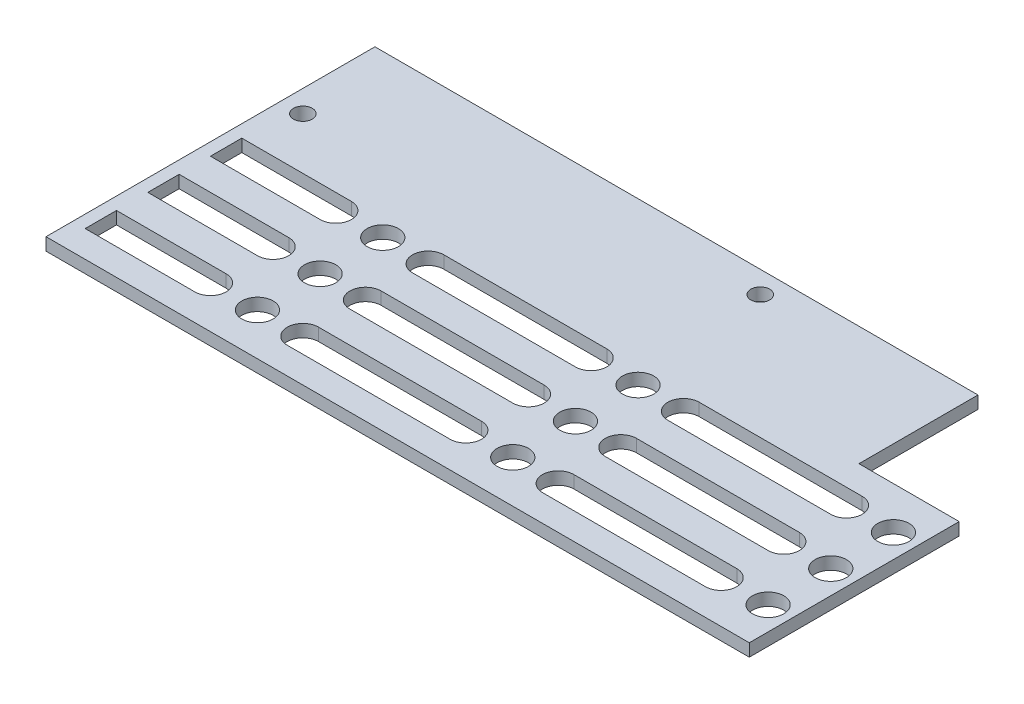
from build123d import *
from build123d.topology import SkipClean

# Parameters (mm, degrees)
SKETCH1_R            = 1.5
BOSS_EXTRUDE1_DEPTH  = 2
BOSS_EXTRUDE2_START  = 3
SKETCH2_R            = 2.5
SKETCH2_R_2          = 1.5
BOSS_EXTRUDE2_DEPTH  = 3
CUT_EXTRUDE1_REACH   = 126.021
SKETCH3_R            = 2.5
LPATTERN1_COUNT      = 3
LPATTERN1_PITCH      = 40.75
LPATTERN1_COUNT_DIR2 = 3
LPATTERN1_PITCH_DIR2 = 10
SKETCH4_W            = 2
SKETCH4_H            = 29.25
BOSS_EXTRUDE3_DEPTH  = 2


with BuildPart() as part:
    # Sketch1 → Boss-Extrude1 (new body)
    with BuildSketch(Plane(origin=(0, 0, 0), x_dir=(1, 0, 0), z_dir=(0, 1, 0))):
        Polygon((-112.25, 0), (0, 0), (0, 33.5), (-16, 33.5), (-16, 52.5), (-112.25, 52.5), align=None)
        with Locations(Location((-47.25, 49, 0), (0, 0, 270))):
            Circle(SKETCH1_R, mode=Mode.SUBTRACT)
        with Locations(Location((-108.75, 37.5, 0), (0, 0, 270))):
            Circle(SKETCH1_R, mode=Mode.SUBTRACT)
    extrude(amount=BOSS_EXTRUDE1_DEPTH)

    # Sketch2 → Boss-Extrude2 (add)
    with SkipClean():  # the faces are left unmerged after this step: merging them gives an invalid solid
        with BuildSketch(Plane(origin=(0, 0, 0), x_dir=(-1, 0, 0), z_dir=(0, -1, 0)).offset(BOSS_EXTRUDE2_START)):
            with Locations(Location((108.75, 37.5, 0), (0, 0, 90))):
                Circle(SKETCH2_R)
            with Locations(Location((108.75, 37.5, 0), (0, 0, 90))):
                Circle(SKETCH2_R_2, mode=Mode.SUBTRACT)
        extrude(amount=-BOSS_EXTRUDE2_DEPTH)

    # Sketch3 → Cut-Extrude1 (cut, up to next)
    with BuildSketch(Plane(origin=(0, 2, 0), x_dir=(1, 0, 0), z_dir=(0, 1, 0)), mode=Mode.PRIVATE) as cut_extrude1_sk1:
        with Locations(Location((-3.75, 26.75, 0), (0, 0, 270))):
            Circle(SKETCH3_R)
    cut_extrude1_tool1 = extrude(cut_extrude1_sk1.sketch, amount=-CUT_EXTRUDE1_REACH, mode=Mode.PRIVATE) & part.part
    # Sketch3 → Cut-Extrude1 (cut, up to next)
    with BuildSketch(Plane(origin=(0, 2, 0), x_dir=(1, 0, 0), z_dir=(0, 1, 0)), mode=Mode.PRIVATE) as cut_extrude1_sk2:
        with BuildLine():
            Line((-37.25, 29.25), (-11.25, 29.25))
            ThreePointArc((-11.25, 29.25), (-8.75, 26.75), (-11.25, 24.25))
            Line((-11.25, 24.25), (-37.25, 24.25))
            ThreePointArc((-37.25, 24.25), (-39.75, 26.75), (-37.25, 29.25))
        make_face()
    cut_extrude1_tool2 = extrude(cut_extrude1_sk2.sketch, amount=-CUT_EXTRUDE1_REACH, mode=Mode.PRIVATE) & part.part
    cut_extrude1_1 = cut_extrude1_tool1.solids().sort_by_distance((-3.75, 2, -26.75))[0]
    add(cut_extrude1_1, mode=Mode.SUBTRACT)
    cut_extrude1_2 = cut_extrude1_tool2.solids().sort_by_distance((-24.25, 2, -26.75))[0]
    add(cut_extrude1_2, mode=Mode.SUBTRACT)
    cut_extrude1 = cut_extrude1_1 + cut_extrude1_2  # Cut-Extrude1 as one shape, for the pattern or mirror that repeats it

    # LPattern1: Cut-Extrude1 3 × 3
    with SkipClean():  # the faces are left unmerged after this step: merging them gives an invalid solid
        with Locations(*[(-i * LPATTERN1_PITCH, 0, j * LPATTERN1_PITCH_DIR2) for i in range(LPATTERN1_COUNT) for j in range(LPATTERN1_COUNT_DIR2) if (i, j) != (0, 0)]):
            add(cut_extrude1, mode=Mode.SUBTRACT)

    # Sketch4 → Boss-Extrude3 (add)
    with SkipClean():  # the faces are left unmerged after this step: merging them gives an invalid solid
        with BuildSketch(Plane(origin=(0, 2, 0), x_dir=(1, 0, 0), z_dir=(0, 1, 0))):
            with Locations((-111.25, 14.625)):
                Rectangle(SKETCH4_W, SKETCH4_H)
        extrude(amount=-BOSS_EXTRUDE3_DEPTH)


solid = part.part
